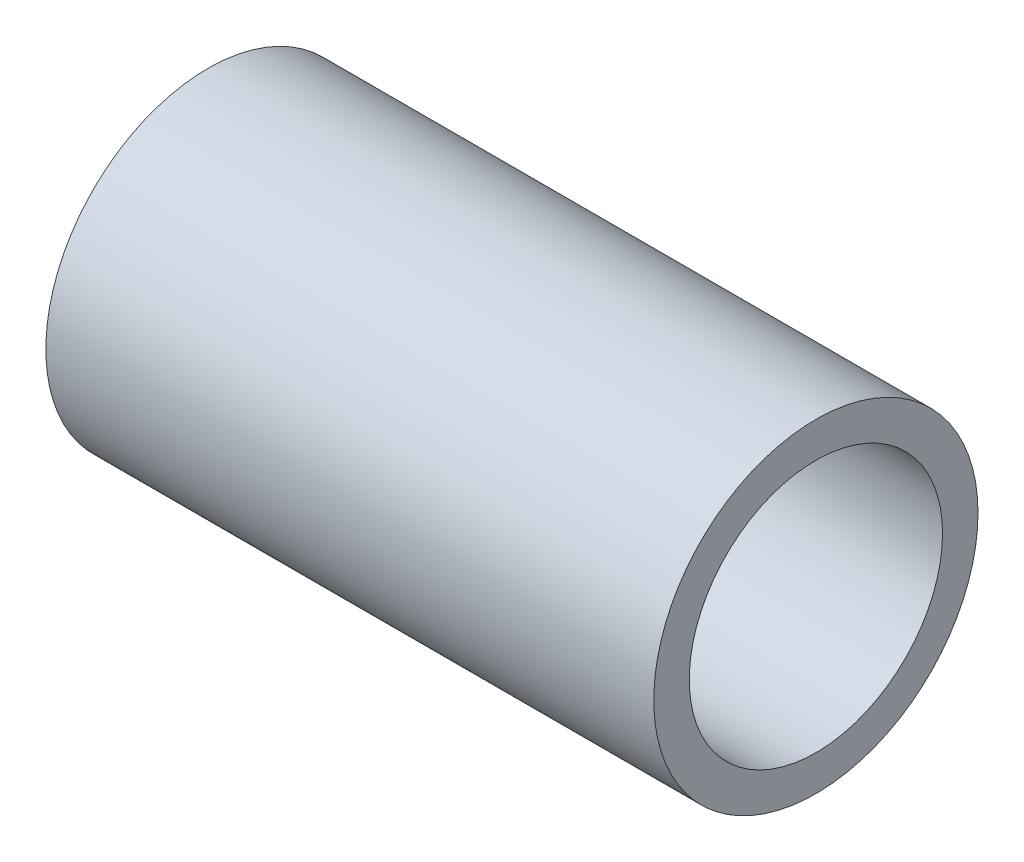
from build123d import *

# Parameters (mm, degrees)
SKETCH_1_R      = 8
SKETCH_1_R_2    = 6.25
EXTRUDE_1_DEPTH = 30


with BuildPart() as part:
    # ｽｹｯﾁ1 → ﾎﾞｽ - 押し出し1 (new body)
    with BuildSketch(Plane(origin=(0, 0, 0), x_dir=(0, 0, -1), z_dir=(1, 0, 0))):
        Circle(SKETCH_1_R)
        Circle(SKETCH_1_R_2, mode=Mode.SUBTRACT)
    extrude(amount=EXTRUDE_1_DEPTH)


solid = part.part
